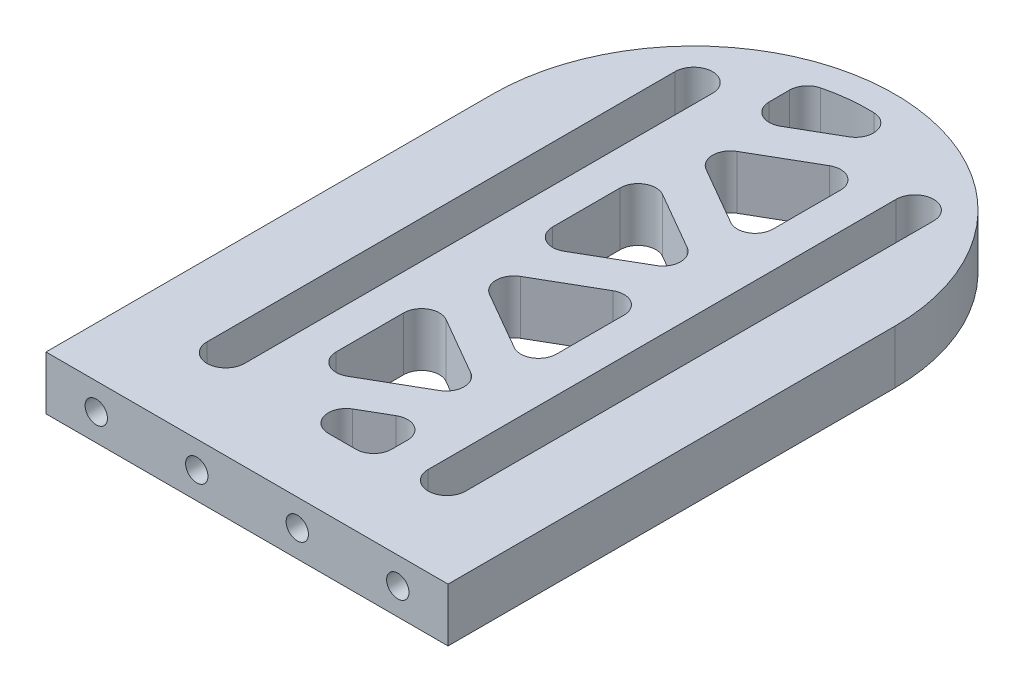
from build123d import *

# Parameters (mm, degrees)
EXTRUDE_1_DEPTH     = 6
CUT_EXTRUDE_1_DEPTH = 56.156595254
CUT_EXTRUDE_2_REACH = 57.157
FILLET_18_R         = 2
M3X0_51_D           = 2.5
M3X0_51_DEPTH       = 8.5
M3X0_51_TIP         = 0.751075774


with BuildPart() as part:
    # Эскиз1 → Бобышка-Вытянуть1 (new body)
    with BuildSketch(Plane(origin=(0, 0, 0), x_dir=(1, 0, 0), z_dir=(0, 1, 0))):
        with BuildLine():
            Line((-22.5, 0), (-22.5, -50))
            Line((-22.5, -50), (22.5, -50))
            Line((22.5, -50), (22.5, 0))
            ThreePointArc((22.5, 0), (0, 22.5), (-22.5, 0))
        make_face()
    extrude(amount=EXTRUDE_1_DEPTH)

    # Эскиз2 → Вырез-Вытянуть1 (cut, through all)
    with BuildSketch(Plane(origin=(0, 6, 0), x_dir=(1, 0, 0), z_dir=(0, 1, 0))):
        with BuildLine():
            Line((-10.274368671, 12.374368671), (-10.274368671, -40))
            ThreePointArc((-10.274368671, -40), (-12.374368671, -42.1), (-14.474368671, -40))
            Line((-14.474368671, -40), (-14.474368671, 12.374368671))
            ThreePointArc((-14.474368671, 12.374368671), (-12.374368671, 14.474368671), (-10.274368671, 12.374368671))
        make_face()
        with BuildLine():
            Line((10.274368671, 12.374368671), (10.274368671, -40))
            ThreePointArc((10.274368671, -40), (12.374368671, -42.1), (14.474368671, -40))
            Line((14.474368671, -40), (14.474368671, 12.374368671))
            ThreePointArc((14.474368671, 12.374368671), (12.374368671, 14.474368671), (10.274368671, 12.374368671))
        make_face()
    extrude(amount=-CUT_EXTRUDE_1_DEPTH, mode=Mode.SUBTRACT)

    # Эскиз11 → Вырез-Вытянуть2 (cut, up to next)
    with BuildSketch(Plane(origin=(0, 6, 0), x_dir=(1, 0, 0), z_dir=(0, 1, 0)), mode=Mode.PRIVATE) as cut_extrude_2_sk1:
        with BuildLine():
            Line((6.274368671, 18.5), (-6.274368671, 11.254983118))
            Line((-6.274368671, 11.254983118), (-6.274368671, 18.5))
            ThreePointArc((-6.274368671, 18.5), (0, 19.535037809), (6.274368671, 18.5))
        make_face()
    cut_extrude_2_tool1 = extrude(cut_extrude_2_sk1.sketch, amount=-CUT_EXTRUDE_2_REACH, mode=Mode.PRIVATE) & part.part
    # Эскиз11 → Вырез-Вытянуть2 (cut, up to next)
    with BuildSketch(Plane(origin=(0, 6, 0), x_dir=(1, 0, 0), z_dir=(0, 1, 0)), mode=Mode.PRIVATE) as cut_extrude_2_sk2:
        Polygon((6.274368671, 13.627163728), (-6.274368671, 6.382146846), (6.274368671, -0.862870036), align=None)
    cut_extrude_2_tool2 = extrude(cut_extrude_2_sk2.sketch, amount=-CUT_EXTRUDE_2_REACH, mode=Mode.PRIVATE) & part.part
    # Эскиз11 → Вырез-Вытянуть2 (cut, up to next)
    with BuildSketch(Plane(origin=(0, 6, 0), x_dir=(1, 0, 0), z_dir=(0, 1, 0)), mode=Mode.PRIVATE) as cut_extrude_2_sk3:
        Polygon((-6.274368671, 1.509310574), (6.274368671, -5.735706308), (-6.274368671, -12.98072319), align=None)
    cut_extrude_2_tool3 = extrude(cut_extrude_2_sk3.sketch, amount=-CUT_EXTRUDE_2_REACH, mode=Mode.PRIVATE) & part.part
    # Эскиз11 → Вырез-Вытянуть2 (cut, up to next)
    with BuildSketch(Plane(origin=(0, 6, 0), x_dir=(1, 0, 0), z_dir=(0, 1, 0)), mode=Mode.PRIVATE) as cut_extrude_2_sk4:
        Polygon((-6.274368671, -17.853559462), (6.274368671, -10.60854258), (6.274368671, -25.098576344), align=None)
    cut_extrude_2_tool4 = extrude(cut_extrude_2_sk4.sketch, amount=-CUT_EXTRUDE_2_REACH, mode=Mode.PRIVATE) & part.part
    # Эскиз11 → Вырез-Вытянуть2 (cut, up to next)
    with BuildSketch(Plane(origin=(0, 6, 0), x_dir=(1, 0, 0), z_dir=(0, 1, 0)), mode=Mode.PRIVATE) as cut_extrude_2_sk5:
        Polygon((-6.274368671, -22.726395734), (6.274368671, -29.971412616), (-6.274368671, -37.216429498), align=None)
    cut_extrude_2_tool5 = extrude(cut_extrude_2_sk5.sketch, amount=-CUT_EXTRUDE_2_REACH, mode=Mode.PRIVATE) & part.part
    # Эскиз11 → Вырез-Вытянуть2 (cut, up to next)
    with BuildSketch(Plane(origin=(0, 6, 0), x_dir=(1, 0, 0), z_dir=(0, 1, 0)), mode=Mode.PRIVATE) as cut_extrude_2_sk6:
        Polygon((-6.274368671, -42.08926577), (6.274368671, -34.844248888), (6.274368671, -42.08926577), align=None)
    cut_extrude_2_tool6 = extrude(cut_extrude_2_sk6.sketch, amount=-CUT_EXTRUDE_2_REACH, mode=Mode.PRIVATE) & part.part
    add(cut_extrude_2_tool1.solids().sort_by_distance((-1.755291, 6, -16.539864))[0], mode=Mode.SUBTRACT)
    add(cut_extrude_2_tool2.solids().sort_by_distance((2.091456, 6, -6.382147))[0], mode=Mode.SUBTRACT)
    add(cut_extrude_2_tool3.solids().sort_by_distance((-2.091456, 6, 5.735706))[0], mode=Mode.SUBTRACT)
    add(cut_extrude_2_tool4.solids().sort_by_distance((2.091456, 6, 17.853559))[0], mode=Mode.SUBTRACT)
    add(cut_extrude_2_tool5.solids().sort_by_distance((-2.091456, 6, 29.971413))[0], mode=Mode.SUBTRACT)
    add(cut_extrude_2_tool6.solids().sort_by_distance((2.091456, 6, 39.67426))[0], mode=Mode.SUBTRACT)

    # Скругление18
    fillet_18_edges = [part.edges().sort_by_distance(p)[0] for p in [
        (6.274368671, 3, -13.627163728),
        (6.274368671, 3, 0.862870036),
        (-6.274368671, 3, -6.382146846),
        (-6.274368671, 3, -18.5),
        (6.274368671, 3, -18.5),
        (-6.274368671, 3, -11.254983118),
        (-6.274368671, 3, 12.98072319),
        (-6.274368671, 3, -1.509310574),
        (6.274368671, 3, 5.735706308),
        (6.274368671, 3, 25.098576344),
        (-6.274368671, 3, 17.853559462),
        (6.274368671, 3, 10.60854258),
        (-6.274368671, 3, 37.216429498),
        (-6.274368671, 3, 22.726395734),
        (6.274368671, 3, 29.971412616),
        (6.274368671, 3, 42.08926577),
        (-6.274368671, 3, 42.08926577),
        (6.274368671, 3, 34.844248888),
    ]]
    fillet(fillet_18_edges, radius=FILLET_18_R)

    # Отверстие обработанное метчиком M3x0.51
    with Locations(Plane.XY.offset(50)):
        with Locations((-16.875, 3), (-5.625, 3), (5.625, 3), (16.875, 3)):
            Hole(M3X0_51_D / 2, depth=M3X0_51_DEPTH)
            with Locations((0, 0, -(M3X0_51_DEPTH + M3X0_51_TIP / 2))):  # 118° drill point
                Cone(0, M3X0_51_D / 2, M3X0_51_TIP, mode=Mode.SUBTRACT)


solid = part.part
